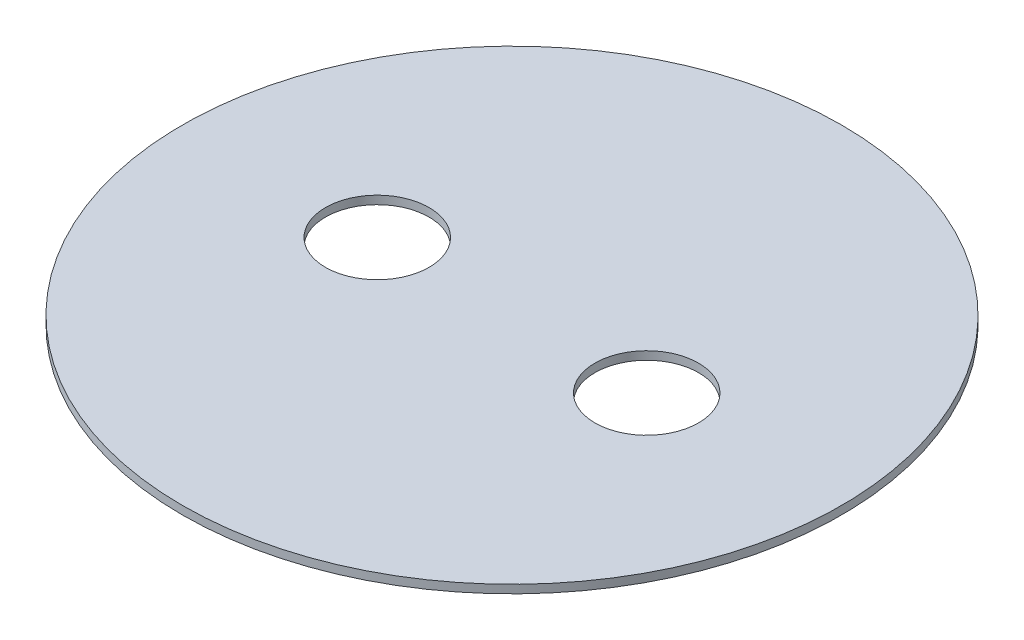
from build123d import *

# Parameters (mm, degrees)
SKETCH1_R      = 79.5
SKETCH1_R_2    = 12.5
EXTRUDE1_DEPTH = 2


with BuildPart() as part:
    # Sketch1 → Extrude1 (new body)
    with BuildSketch(Plane(origin=(0, 0, 0), x_dir=(1, 0, 0), z_dir=(0, 1, 0))):
        with Locations(Location((0, 0, 0), (0, 0, 270))):
            Circle(SKETCH1_R)
        with Locations(Location((-32.5, 0, 0), (0, 0, 270))):
            Circle(SKETCH1_R_2, mode=Mode.SUBTRACT)
        with Locations(Location((32.5, 0, 0), (0, 0, 270))):
            Circle(SKETCH1_R_2, mode=Mode.SUBTRACT)
    extrude(amount=EXTRUDE1_DEPTH)


solid = part.part
